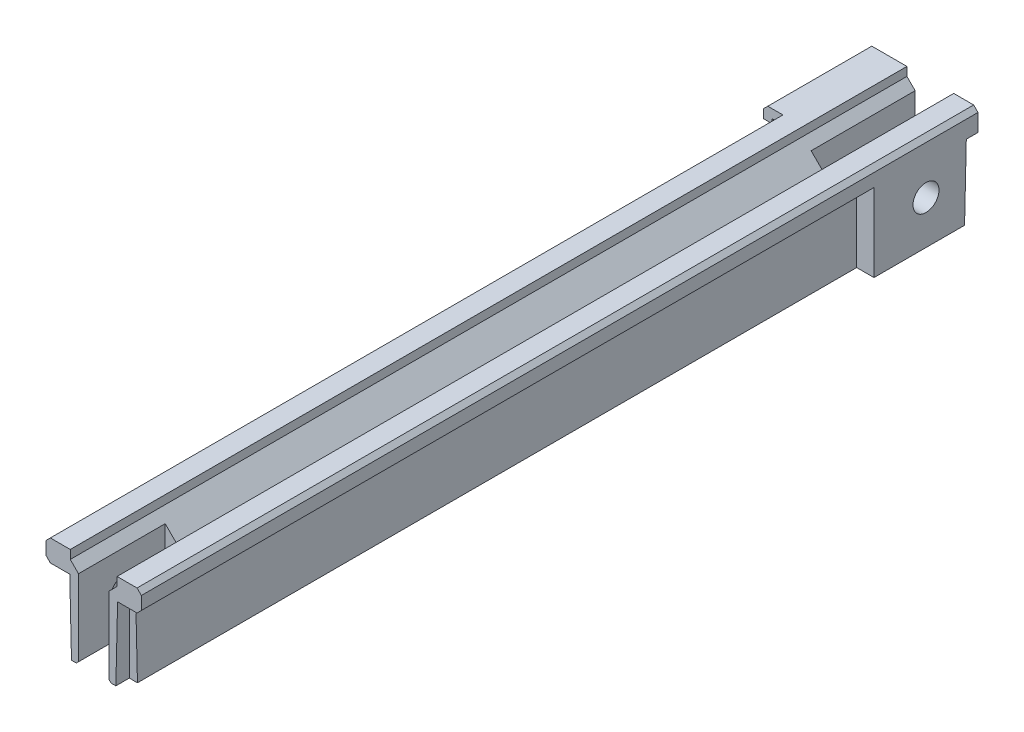
from build123d import *

# Parameters (mm, degrees)
SKETCH1_W                        = 5.5
SKETCH1_H                        = 11
MAIN_BASE_DEPTH                  = 96.52
SIDE_CUT_OUT_DEPTH               = 84.52
TOP_RUBBER_BAND_CUT_OUT_DEPTH    = 98.300361767
BOTTOM_RUBBER_BAND_CUT_OUT_DEPTH = 98.300361767
SKETCH6_W                        = 1.75
SKETCH6_H                        = 11
MOTOR_PULLEY_CUT_OUT_DEPTH       = 12
SKETCH7_W                        = 1.75
SKETCH7_H                        = 11
PULLEY_CUT_OUT_DEPTH             = 10
SKETCH11_R                       = 1.5
MOTOR_SHAFT_CUT_OUT_DEPTH        = 98.217143036
SKETCH17_W                       = 3.14
SKETCH17_H                       = 2.8
MOUNTING_POINTS_DEPTH            = 8.5
MOUNTING_POINTS_DRAFT            = -1.348
MOUNTING_POINTS_PROFILE_2_DEPTH  = 8.5
MOUNTING_POINTS_PROFILE_2_DRAFT  = -1.348
SKETCH13_W                       = 1
SKETCH13_H                       = 0.5
BOSS_EXTRUDE3_DEPTH              = 12
RAIL_CHAMFER_SIZE                = 0.5


with BuildPart() as part:
    # Sketch1 → main_base (new body)
    with BuildSketch(Plane.XY):
        with Locations((2.75, 5.5)):
            Rectangle(SKETCH1_W, SKETCH1_H)
    extrude(amount=-MAIN_BASE_DEPTH)

    # Sketch3 → side_cut_out (cut)
    with BuildSketch(Plane.XY):
        Polygon((5.5, 9), (3.5, 7), (3.5, 0), (5.5, 0), align=None)
    extrude(amount=-SIDE_CUT_OUT_DEPTH, mode=Mode.SUBTRACT)

    # Sketch4 → top_rubber_band_cut_out (cut, through all)
    with BuildSketch(Plane.XY):
        Polygon((0, 7.3), (0, 11), (2.7, 11), (2.7, 10), align=None)
    extrude(amount=-TOP_RUBBER_BAND_CUT_OUT_DEPTH, mode=Mode.SUBTRACT)

    # Sketch5 → bottom_rubber_band_cut_out (cut, through all)
    with BuildSketch(Plane.XY):
        Polygon((2, 0), (0, 2), (0, 0), align=None)
    extrude(amount=-BOTTOM_RUBBER_BAND_CUT_OUT_DEPTH, mode=Mode.SUBTRACT)

    # Sketch6 → motor_pulley_cut_out (cut)
    with BuildSketch(Plane(origin=(0, 0, -96.52), x_dir=(-1, 0, 0), z_dir=(0, 0, -1))):
        with Locations((-0.875, 5.5)):
            Rectangle(SKETCH6_W, SKETCH6_H)
    extrude(amount=-MOTOR_PULLEY_CUT_OUT_DEPTH, mode=Mode.SUBTRACT)

    # Sketch7 → pulley_cut_out (cut)
    with BuildSketch(Plane.XY):
        with Locations((0.875, 5.5)):
            Rectangle(SKETCH7_W, SKETCH7_H)
    extrude(amount=-PULLEY_CUT_OUT_DEPTH, mode=Mode.SUBTRACT)

    # Sketch10 → half_circle_cut_out (revolve, cut)
    with BuildSketch(Plane(origin=(0, 5, 0), x_dir=(1, 0, 0), z_dir=(0, 1, 0))):
        with BuildLine():
            Line((1.5, 5), (1.5, 3.75))
            ThreePointArc((1.5, 3.75), (2.383883476, 4.116116524), (2.75, 5))
            Line((2.75, 5), (1.5, 5))
        make_face()
    revolve(axis=Axis((2.75, 5, -5), (-1, 0, 0)), mode=Mode.SUBTRACT)

    # Sketch11 → motor_shaft_cut_out (cut, through all)
    with BuildSketch(Plane.ZY.offset(-1.75)):
        with Locations((-90.52, 5)):
            Circle(SKETCH11_R)
    extrude(amount=-MOTOR_SHAFT_CUT_OUT_DEPTH, mode=Mode.SUBTRACT)


with BuildPart() as mounting_points_tool:
    # Sketch17 → mounting_points (with draft: the straight prism first)
    with BuildSketch(Plane.XZ):
        with Locations((4.13, -0.15)):
            Rectangle(SKETCH17_W, SKETCH17_H)
    extrude(amount=-MOUNTING_POINTS_DEPTH)
    # mounting_points: the draft: its side faces are tilted about the plane it starts from
    mounting_points_sides = [mounting_points_tool.faces().sort_by_distance(p)[0] for p in [
        (4.13, 4.25, 1.25),
        (2.56, 4.25, -0.15),
        (4.13, 4.25, -1.55),
        (5.7, 4.25, -0.15),
    ]]
    draft(mounting_points_sides, Plane.XZ, MOUNTING_POINTS_DRAFT)


with BuildPart() as part_1:
    add(part.part)

    # mounting_points: cut by mounting_points_tool
    add(mounting_points_tool.part, mode=Mode.SUBTRACT)


with BuildPart() as mounting_points_profile_2_tool:
    # Sketch17 → mounting_points profile 2 (with draft: the straight prism first)
    with BuildSketch(Plane.XZ):
        with Locations((4.13, -96.37)):
            Rectangle(SKETCH17_W, SKETCH17_H)
    extrude(amount=-MOUNTING_POINTS_PROFILE_2_DEPTH)
    # mounting_points profile 2: the draft: its side faces are tilted about the plane it starts from
    mounting_points_profile_2_sides = [mounting_points_profile_2_tool.faces().sort_by_distance(p)[0] for p in [
        (4.13, 4.25, -97.77),
        (5.7, 4.25, -96.37),
        (4.13, 4.25, -94.97),
        (2.56, 4.25, -96.37),
    ]]
    draft(mounting_points_profile_2_sides, Plane.XZ, MOUNTING_POINTS_PROFILE_2_DRAFT)


with BuildPart() as part_2:
    add(part_1.part)

    # mounting_points profile 2: cut by mounting_points_profile_2_tool
    add(mounting_points_profile_2_tool.part, mode=Mode.SUBTRACT)

    # final_mirror: part across plane


with BuildPart() as part_3:
    add(part_2.part)
    add(part_2.part.mirror(Plane(origin=(0, 0, 0), x_dir=(0, 0, 1), z_dir=(1, 0, 0))))

    # Sketch13 → Boss-Extrude3 (add)
    with BuildSketch(Plane(origin=(0, 0, -96.52), x_dir=(-1, 0, 0), z_dir=(0, 0, -1))):
        Polygon((7.25, 11), (5.5, 11), (5.5, 10), (6.25, 10), (7.25, 10), align=None)
        with Locations((6.75, 9.75)):
            Rectangle(SKETCH13_W, SKETCH13_H)
    extrude(amount=-BOSS_EXTRUDE3_DEPTH)

    # rail_chamfer
    rail_chamfer_edges = [part_3.edges().sort_by_distance(p)[0] for p in [
        (-5.5, 11, -42.26),
        (-7.25, 11, -90.52),
        (5.5, 11, -48.26),
    ]]
    chamfer(rail_chamfer_edges, length=RAIL_CHAMFER_SIZE)


solid = part_3.part
